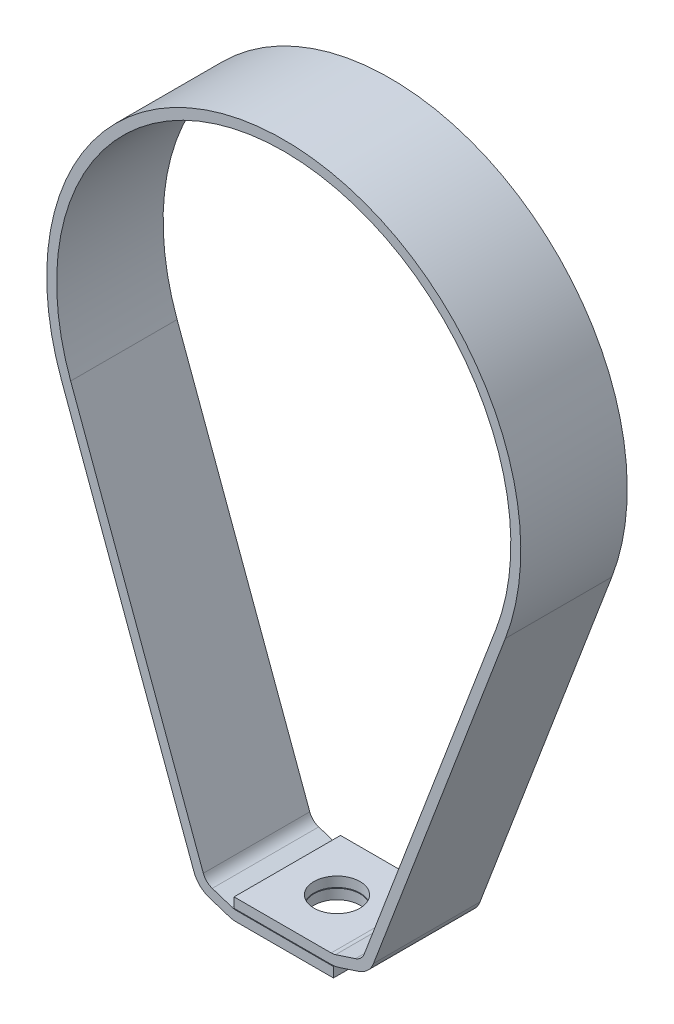
from build123d import *

# Parameters (mm, degrees)
EXTRUSION4_DEPTH        = 7.5
ESQUISSE2_R             = 3.25
ENL_V_MAT_EXTRU_1_DEPTH = 15


with BuildPart() as part:
    # Esquisse1 → Extrusion4 (new, symmetric)
    with BuildSketch(Plane.XY):
        with BuildLine():
            Line((-30.026499529, -11.063874821), (-11.335566656, -61.789619296))
            ThreePointArc((-11.335566656, -61.789619296), (-10.845370144, -62.539560252), (-10.076944424, -63.000240152))
            Line((-10.076944424, -63.000240152), (-7.301265108, -63.902113033))
            ThreePointArc((-7.301265108, -63.902113033), (-6.996100049, -63.975376681), (-6.683231119, -64))
            Line((-6.683231119, -64), (7, -64))
            Line((7, -64), (7, -65.4))
            Line((7, -65.4), (-6.683231119, -65.4))
            ThreePointArc((-6.683231119, -65.4), (-7.2151083, -65.358140358), (-7.7338889, -65.233592155))
            Line((-7.7338889, -65.233592155), (-10.509568216, -64.331719275))
            ThreePointArc((-10.509568216, -64.331719275), (-11.81589194, -63.548563445), (-12.64922601, -62.27366382))
            Line((-12.64922601, -62.27366382), (-31.340158883, -11.547919345))
            ThreePointArc((-31.340158883, -11.547919345), (0.161979155, 33.399607225), (31.226678681, -11.851351759))
            Line((31.226678681, -11.851351759), (12.649044499, -60.800857693))
            ThreePointArc((12.649044499, -60.800857693), (11.815350768, -62.056270768), (10.520938582, -62.828024819))
            Line((10.520938582, -62.828024819), (7.7338889, -63.733592155))
            ThreePointArc((7.7338889, -63.733592155), (7.2151083, -63.858140358), (6.683231119, -63.9))
            Line((6.683231119, -63.9), (-7, -63.9))
            Line((-7, -63.9), (-7, -62.5))
            Line((-7, -62.5), (6.683231119, -62.5))
            ThreePointArc((6.683231119, -62.5), (6.996100049, -62.475376681), (7.301265108, -62.402113033))
            Line((7.301265108, -62.402113033), (10.08831479, -61.496545697))
            ThreePointArc((10.08831479, -61.496545697), (10.849733723, -61.042572725), (11.3401418, -60.304094446))
            Line((11.3401418, -60.304094446), (29.917775982, -11.354588512))
            ThreePointArc((29.917775982, -11.354588512), (0.155189609, 31.999623688), (-30.026499529, -11.063874821))
        make_face()
    extrude(amount=EXTRUSION4_DEPTH, both=True)

    # Esquisse2 → Enlèv. mat.-Extru.1 (cut)
    with BuildSketch(Plane.XZ.offset(65.4)):
        Circle(ESQUISSE2_R)
    extrude(amount=-ENL_V_MAT_EXTRU_1_DEPTH, mode=Mode.SUBTRACT)


solid = part.part
